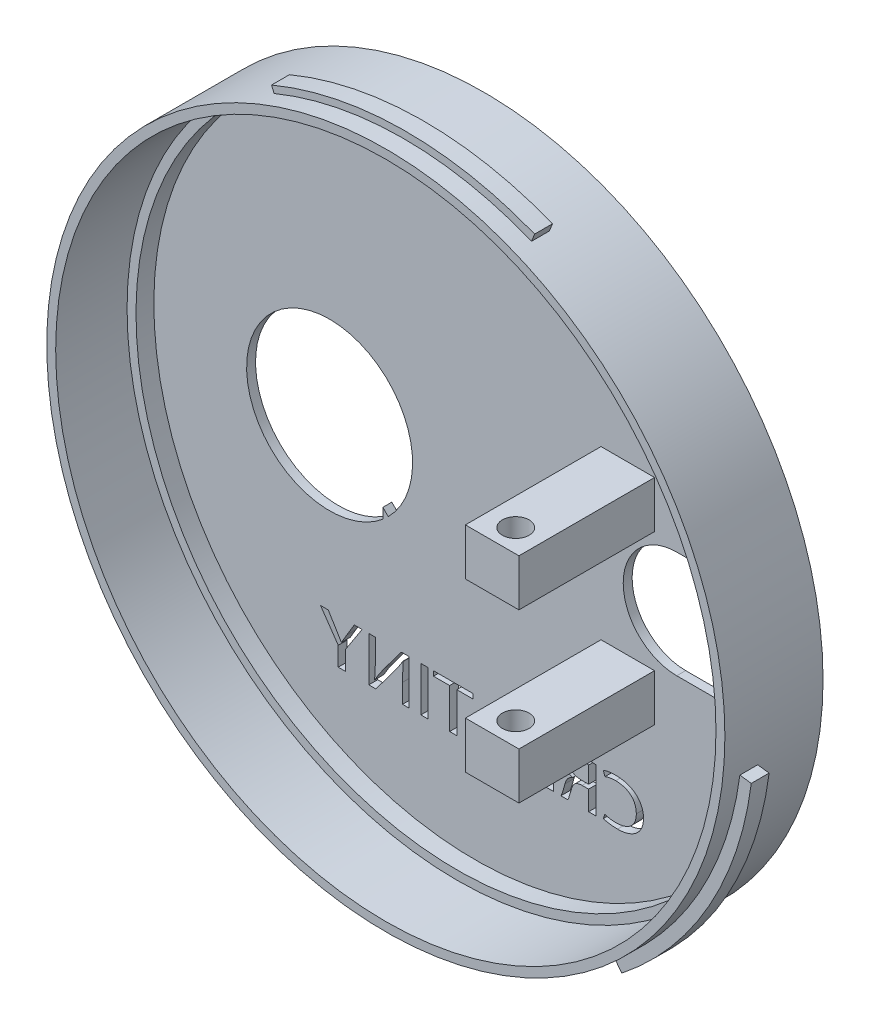
from build123d import *

# Parameters (mm, degrees)
SKETCH2_R           = 38
BOSS_EXTRUDE1_DEPTH = 10
BOSS_EXTRUDE2_START = -1
SKETCH3_R           = 38
BOSS_EXTRUDE2_DEPTH = 1
CUT_EXTRUDE3_DEPTH  = 11
SKETCH9_W           = 6
SKETCH9_H           = 5.25
BOSS_EXTRUDE3_DEPTH = 15.2
SKETCH10_R          = 1.5
CUT_EXTRUDE5_DEPTH  = 30.2
SKETCH13_W          = 0.801888887
SKETCH13_H          = 5
CUT_EXTRUDE6_DEPTH  = 1
BOSS_EXTRUDE5_START = 6
BOSS_EXTRUDE5_DEPTH = 2
SKETCH17_R          = 37
SKETCH17_R_2        = 34.556106302
CUT_EXTRUDE7_DEPTH  = 8


with BuildPart() as part:
    # Sketch2 → Boss-Extrude1 (new body)
    with BuildSketch(Plane.XY):
        with Locations((25.546999888, -56.770486832)):
            Circle(SKETCH2_R)
        with BuildLine():
            ThreePointArc((60.246626043, -47.182163482), (61.278669634, -52.383257966), (61.535520776, -57.679532627))
            ThreePointArc((61.535520776, -57.679532627), (61.396058346, -60.063662755), (61.098828905, -62.433300048))
            ThreePointArc((61.098828905, -62.433300048), (61.050025307, -62.731626496), (60.998718404, -63.029532627))
            ThreePointArc((60.998718404, -63.029532627), (25.546999888, -92.770486832), (-9.904718628, -63.029532627))
            ThreePointArc((-9.904718628, -63.029532627), (-10.273142163, -60.364568558), (-10.441521001, -57.679532627))
            ThreePointArc((-10.441521001, -57.679532627), (19.044551487, -21.362604026), (59.510267865, -44.833300048))
            Line((59.510267865, -44.833300048), (60.246626043, -44.833300048))
            Line((60.246626043, -44.833300048), (60.246626043, -47.182163482))
        make_face(mode=Mode.SUBTRACT)
    extrude(amount=BOSS_EXTRUDE1_DEPTH)

    # Sketch3 → Boss-Extrude2 (add)
    with BuildSketch(Plane.XY.offset(BOSS_EXTRUDE2_START)):
        with Locations((25.546999888, -56.770486832)):
            Circle(SKETCH3_R)
    extrude(amount=BOSS_EXTRUDE2_DEPTH)

    # Sketch8 → Cut-Extrude3 (cut)
    with BuildSketch(Plane.XY):
        with BuildLine():
            Line((15.21607418, -64.879468912), (15.21607418, -63.720910481))
            Line((15.21607418, -63.720910481), (15.820917047, -64.325753348))
            ThreePointArc((15.820917047, -64.325753348), (2.965046441, -50.890039737), (15.21607418, -64.879468912))
        make_face()
        with BuildLine():
            ThreePointArc((48.150499089, -51.605773888), (42.150499089, -57.605773888), (48.150499089, -63.605773888))
            Line((48.150499089, -63.605773888), (54.980546295, -63.605773888))
            ThreePointArc((54.980546295, -63.605773888), (56.712597103, -63.350336535), (58.297171086, -62.605773888))
            ThreePointArc((58.297171086, -62.605773888), (60.725108942, -55.873723081), (54.980546295, -51.605773888))
            Line((54.980546295, -51.605773888), (48.150499089, -51.605773888))
        make_face()
    extrude(amount=-CUT_EXTRUDE3_DEPTH, mode=Mode.SUBTRACT)

    # Sketch9 → Boss-Extrude3 (add)
    with BuildSketch(Plane.XY):
        with Locations((42.663966204, -48.230773888)):
            Rectangle(SKETCH9_W, SKETCH9_H)
        Polygon((45.663966204, -64.355773888), (39.663966204, -64.355773888), (39.663966204, -69.605773888), (45.663966204, -69.605773888), (45.663966204, -68.202006467), align=None)
    extrude(amount=BOSS_EXTRUDE3_DEPTH)

    # Sketch10 → Cut-Extrude5 (cut)
    with BuildSketch(Plane(origin=(0, -45.605773888, 0), x_dir=(1, 0, 0), z_dir=(0, 1, 0))):
        with Locations(Location((42.746446905, -12.639663568, 0), (0, 0, 270))):
            Circle(SKETCH10_R)
    extrude(amount=-CUT_EXTRUDE5_DEPTH, mode=Mode.SUBTRACT)

    # Sketch13 → Cut-Extrude6 (cut)
    # profile 1 of 8: a face of its own
    with BuildSketch(Plane(origin=(0, 0, -1), x_dir=(-1, 0, 0), z_dir=(0, 0, -1))):
        with BuildLine():
            Line((-40.104244244, -77.420287824), (-39.919238625, -76.89350522))
            add(Edge.make_bspline(
                [(-39.919238625, -76.89350522), (-39.985054462, -76.864755772), (-40.099036406, -76.827670091), (-40.269326593, -76.784978266), (-40.433726419, -76.750793916), (-40.622659337, -76.719221552), (-40.923593217, -76.68878046), (-41.161873876, -76.681558637), (-41.328515256, -76.679507378)],
                knots=[0, 0, 0, 0, 0.150125799, 0.250435981, 0.367340124, 0.501482822, 0.651140633, 1, 1, 1, 1], degree=3))
            add(Edge.make_bspline(
                [(-41.328515256, -76.679507378), (-41.551118359, -76.682349051), (-41.878080869, -76.705107722), (-42.297375573, -76.784199814), (-42.588134212, -76.861666839), (-42.860217223, -76.96378297), (-43.115298375, -77.086364928), (-43.352377266, -77.230635878), (-43.570737258, -77.395446782), (-43.768586362, -77.578162482), (-43.940626331, -77.77856157), (-44.088243958, -77.993415447), (-44.208456776, -78.224037529), (-44.303291152, -78.469702927), (-44.398543708, -78.823687705), (-44.424363123, -79.10307879), (-44.42885831, -79.2920717)],
                knots=[0, 0, 0, 0, 0.14690636, 0.215514431, 0.281217447, 0.345141972, 0.406923098, 0.467644647, 0.527895849, 0.58710749, 0.644941933, 0.701759103, 0.758694972, 0.816084307, 0.875151254, 1, 1, 1, 1], degree=3))
            add(Edge.make_bspline(
                [(-44.42885831, -79.2920717), (-44.426031396, -79.486385517), (-44.396500906, -79.770583678), (-44.304866617, -80.130869848), (-44.212364843, -80.375892275), (-44.095365607, -80.602699721), (-43.952072876, -80.810270398), (-43.785409494, -81.00030132), (-43.593503229, -81.169054285), (-43.383016352, -81.318726034), (-43.15737618, -81.449925507), (-42.917197587, -81.560675047), (-42.662616673, -81.650671869), (-42.393773518, -81.721686307), (-42.007784356, -81.789137586), (-41.708668421, -81.809337581), (-41.505402049, -81.809224359)],
                knots=[0, 0, 0, 0, 0.134054828, 0.196187605, 0.256037942, 0.314374007, 0.371821189, 0.429644386, 0.488326952, 0.547713857, 0.60759415, 0.668157831, 0.729921145, 0.793672145, 0.859786589, 1, 1, 1, 1], degree=3))
            add(Edge.make_bspline(
                [(-41.505402049, -81.809224359), (-41.333410545, -81.807122474), (-41.084443573, -81.799517854), (-40.765397705, -81.768840057), (-40.554487288, -81.737795521), (-40.364707434, -81.701640626), (-40.156901483, -81.653296502), (-40.013719027, -81.612905596), (-39.928429493, -81.578735508)],
                knots=[0, 0, 0, 0, 0.322335604, 0.466303064, 0.600284204, 0.721615014, 0.82815434, 1, 1, 1, 1], degree=3))
            Line((-39.928429493, -81.578735508), (-40.086584879, -81.068276407))
            add(Edge.make_bspline(
                [(-40.086584879, -81.068276407), (-40.171611189, -81.101493752), (-40.30657226, -81.146483426), (-40.497283578, -81.191391532), (-40.825450429, -81.25314188), (-41.108885014, -81.275623379), (-41.338163627, -81.276419899)],
                knots=[0, 0, 0, 0, 0.214735163, 0.334000252, 0.4606071, 1, 1, 1, 1], degree=3))
            add(Edge.make_bspline(
                [(-41.338163627, -81.276419899), (-41.510005248, -81.275914135), (-41.760830088, -81.256612925), (-42.082580191, -81.199084831), (-42.302064223, -81.139444563), (-42.505273326, -81.061809025), (-42.69374664, -80.969672613), (-42.865939974, -80.85993191), (-43.021825866, -80.734239277), (-43.160660588, -80.594136459), (-43.28258322, -80.441837951), (-43.384959772, -80.275869028), (-43.469946918, -80.098892901), (-43.535875196, -79.908969976), (-43.598992895, -79.633520332), (-43.619598338, -79.417687433), (-43.619467229, -79.270630877)],
                knots=[0, 0, 0, 0, 0.15004045, 0.219227057, 0.285263153, 0.348397162, 0.408984868, 0.468216069, 0.526376485, 0.583545824, 0.640194637, 0.696412641, 0.753518027, 0.811369344, 0.871641, 1, 1, 1, 1], degree=3))
            add(Edge.make_bspline(
                [(-43.619467229, -79.270630877), (-43.617636925, -79.114705853), (-43.597149875, -78.88577308), (-43.527547461, -78.594835206), (-43.456604372, -78.396437312), (-43.367004699, -78.212773824), (-43.259438979, -78.042522237), (-43.130649567, -77.887881571), (-42.984789233, -77.747148198), (-42.822094854, -77.62282396), (-42.645363068, -77.514036366), (-42.454553552, -77.421708998), (-42.250361244, -77.345601387), (-42.032533856, -77.286473016), (-41.716414469, -77.230720949), (-41.470669745, -77.212216707), (-41.302786268, -77.212311838)],
                knots=[0, 0, 0, 0, 0.133608295, 0.195976265, 0.255816817, 0.313729074, 0.370711517, 0.427897521, 0.485702881, 0.543992557, 0.602953592, 0.663194488, 0.725286128, 0.789374094, 0.856264557, 1, 1, 1, 1], degree=3))
            add(Edge.make_bspline(
                [(-41.302786268, -77.212311838), (-41.183720381, -77.215324772), (-41.00941851, -77.221832998), (-40.784688007, -77.247779023), (-40.629894893, -77.269217953), (-40.484815105, -77.29878616), (-40.308200377, -77.341965395), (-40.183523487, -77.387908531), (-40.104244244, -77.420287824)],
                knots=[0, 0, 0, 0, 0.292162388, 0.427031541, 0.554525321, 0.675141959, 0.789885124, 1, 1, 1, 1], degree=3))
        make_face()
    # profile 2 of 8: a face of its own
    with BuildSketch(Plane(origin=(0, 0, -1), x_dir=(-1, 0, 0), z_dir=(0, 0, -1))):
        with BuildLine():
            Line((-39.072940642, -81.743830895), (-38.271051756, -81.743830895))
            Line((-38.271051756, -81.743830895), (-38.271051756, -79.548290586))
            Line((-38.271051756, -79.548290586), (-37.542296178, -79.548290586))
            add(Edge.make_bspline(
                [(-37.542296178, -79.548290586), (-37.460927165, -79.551848822), (-37.342079172, -79.559952537), (-37.189553329, -79.586263277), (-37.085678143, -79.612444724), (-36.990001831, -79.647418472), (-36.900961532, -79.686919632), (-36.819233771, -79.733670014), (-36.745528549, -79.789643167), (-36.677318565, -79.852126403), (-36.614814129, -79.923337557), (-36.558347658, -80.003827619), (-36.503704784, -80.091289976), (-36.457798153, -80.19003106), (-36.396535297, -80.335349471), (-36.362866615, -80.452606341), (-36.343523833, -80.533495371)],
                knots=[0, 0, 0, 0, 0.14326879, 0.208951182, 0.271875185, 0.33128654, 0.387797679, 0.442962574, 0.496357282, 0.550149584, 0.605343085, 0.662520635, 0.722851415, 0.786346628, 0.853657941, 1, 1, 1, 1], degree=3))
            add(Edge.make_bspline(
                [(-36.343523833, -80.533495371), (-36.307360806, -80.679658413), (-36.245887827, -80.886249944), (-36.172934839, -81.149914949), (-36.1206278, -81.315249423), (-36.075512627, -81.458876407), (-36.020017914, -81.600383484), (-35.981797232, -81.69478214), (-35.949012684, -81.744901889)],
                knots=[0, 0, 0, 0, 0.35368249, 0.506518283, 0.642777006, 0.761213721, 0.860089839, 1, 1, 1, 1], degree=3))
            Line((-35.949012684, -81.744901889), (-35.171586018, -81.743830895))
            add(Edge.make_bspline(
                [(-35.171586018, -81.743830895), (-35.209472299, -81.680101131), (-35.258101821, -81.566643814), (-35.322309856, -81.398263236), (-35.376265226, -81.235919501), (-35.434204564, -81.050085609), (-35.520316261, -80.754216174), (-35.579949217, -80.518228992), (-35.623112169, -80.353392455)],
                knots=[0, 0, 0, 0, 0.151417113, 0.252398818, 0.369031531, 0.501655205, 0.651028209, 1, 1, 1, 1], degree=3))
            add(Edge.make_bspline(
                [(-35.623112169, -80.353392455), (-35.656152173, -80.230713566), (-35.71549081, -80.052987181), (-35.832976746, -79.84008722), (-35.929859539, -79.699301887), (-36.043451095, -79.576235639), (-36.220401237, -79.437426771), (-36.376241992, -79.367035461), (-36.485033267, -79.333881306)],
                knots=[0, 0, 0, 0, 0.272813509, 0.398602998, 0.520133142, 0.638268868, 0.75608641, 1, 1, 1, 1], degree=3))
            Line((-36.485033267, -79.333881306), (-36.484711864, -79.319577304))
            add(Edge.make_bspline(
                [(-36.484711864, -79.319577304), (-36.407353816, -79.299411684), (-36.294650268, -79.260954484), (-36.151871786, -79.195875809), (-36.050541352, -79.142407445), (-35.954904925, -79.08215084), (-35.86450475, -79.015609808), (-35.780058376, -78.942376622), (-35.70014409, -78.864586639), (-35.628498686, -78.779797319), (-35.56476175, -78.689724613), (-35.510855848, -78.593293474), (-35.465998133, -78.491724112), (-35.429959837, -78.384166205), (-35.395713816, -78.230346337), (-35.38510803, -78.11035658), (-35.382974948, -78.029207206)],
                knots=[0, 0, 0, 0, 0.130854223, 0.194484618, 0.256782832, 0.318309634, 0.379398059, 0.440388328, 0.50120996, 0.561820135, 0.621882741, 0.681613823, 0.742390406, 0.803450803, 0.867043523, 1, 1, 1, 1], degree=3))
            add(Edge.make_bspline(
                [(-35.382974948, -78.029207206), (-35.384249581, -77.932834562), (-35.397978423, -77.789701197), (-35.44881354, -77.607346027), (-35.50161366, -77.479942386), (-35.566863384, -77.36017042), (-35.672135848, -77.214383628), (-35.766622372, -77.118029195), (-35.837520402, -77.063298116)],
                knots=[0, 0, 0, 0, 0.261905724, 0.387865696, 0.512744574, 0.635647397, 0.757360791, 1, 1, 1, 1], degree=3))
            add(Edge.make_bspline(
                [(-35.837520402, -77.063298116), (-35.932188383, -76.993127175), (-36.092508039, -76.904454824), (-36.329059622, -76.818921809), (-36.531024548, -76.76528192), (-36.754885418, -76.72558002), (-37.099388934, -76.683513133), (-37.371538963, -76.676690563), (-37.560290557, -76.676291254)],
                knots=[0, 0, 0, 0, 0.196743967, 0.304307766, 0.419971224, 0.545726921, 0.684173603, 1, 1, 1, 1], degree=3))
            add(Edge.make_bspline(
                [(-37.560290557, -76.676291254), (-37.828080772, -76.677014392), (-38.160452629, -76.6860576), (-38.552822667, -76.713813501), (-38.789625073, -76.736531069), (-38.961899628, -76.756404887), (-39.072940642, -76.773847001)],
                knots=[0, 0, 0, 0, 0.529594647, 0.657124324, 0.777787018, 1, 1, 1, 1], degree=3))
            Line((-39.072940642, -76.773847001), (-39.072940642, -81.743830895))
        make_face()
        with BuildLine():
            Line((-37.48095951, -79.076591426), (-38.271051756, -79.076591426))
            Line((-38.271051756, -79.076591426), (-38.271051756, -77.207615376))
            add(Edge.make_bspline(
                [(-38.271051756, -77.207615376), (-38.232016991, -77.196840319), (-38.166505407, -77.185745807), (-38.071066266, -77.174032113), (-37.981734626, -77.165235529), (-37.880153312, -77.159395029), (-37.720818645, -77.151849712), (-37.59534546, -77.148355564), (-37.50776054, -77.147989368)],
                knots=[0, 0, 0, 0, 0.158137914, 0.259552694, 0.376096226, 0.509138643, 0.65745551, 1, 1, 1, 1], degree=3))
            add(Edge.make_bspline(
                [(-37.50776054, -77.147989368), (-37.409052415, -77.149132246), (-37.264268059, -77.15443253), (-37.07765645, -77.179802597), (-36.948897609, -77.203773336), (-36.828151362, -77.236110092), (-36.715103922, -77.275586781), (-36.609933711, -77.32308064), (-36.512075746, -77.376100421), (-36.423431894, -77.436862466), (-36.346465308, -77.507116762), (-36.28141853, -77.586385613), (-36.227914685, -77.673878523), (-36.183724767, -77.769136693), (-36.144159719, -77.912746557), (-36.13073988, -78.026344914), (-36.1291156, -78.104250088)],
                knots=[0, 0, 0, 0, 0.156480209, 0.229013275, 0.298179052, 0.363814758, 0.42683523, 0.487645763, 0.546422494, 0.602953773, 0.657444431, 0.710935013, 0.764819527, 0.819539052, 0.876690458, 1, 1, 1, 1], degree=3))
            add(Edge.make_bspline(
                [(-36.1291156, -78.104250088), (-36.130441378, -78.175264932), (-36.142429077, -78.27981526), (-36.181459091, -78.412483911), (-36.223077101, -78.50366597), (-36.273119977, -78.590535061), (-36.336392569, -78.670532036), (-36.410922068, -78.744017293), (-36.494438391, -78.813458598), (-36.589069779, -78.873565388), (-36.691253666, -78.927836711), (-36.802303488, -78.972872571), (-36.922106565, -79.00861089), (-37.04970672, -79.039162196), (-37.236537898, -79.067994828), (-37.381798689, -79.075231546), (-37.48095951, -79.076591426)],
                knots=[0, 0, 0, 0, 0.114278379, 0.168309448, 0.221848701, 0.275202354, 0.329267071, 0.385378573, 0.443396432, 0.50368652, 0.565418225, 0.629380707, 0.696135802, 0.766432636, 0.840361, 1, 1, 1, 1], degree=3))
        make_face(mode=Mode.SUBTRACT)
    # profile 3 of 8: a face of its own
    with BuildSketch(Plane(origin=(0, 0, -1), x_dir=(-1, 0, 0), z_dir=(0, 0, -1))):
        Polygon((-31.238108894, -78.874152574), (-33.536917965, -78.874152574), (-33.536917965, -77.280748684), (-31.097185733, -77.280748684), (-31.097185733, -76.747223947), (-34.338806852, -76.747223947), (-34.338806852, -81.740437843), (-30.965070269, -81.740437843), (-30.965070269, -81.206913105), (-33.536917965, -81.206913105), (-33.536917965, -79.407677312), (-31.238108894, -79.407677312), align=None)
    # profile 4 of 8: a face of its own
    with BuildSketch(Plane(origin=(0, 0, -1), x_dir=(-1, 0, 0), z_dir=(0, 0, -1))):
        Polygon((-26.945642454, -80.165786298), (-26.316086279, -81.743830895), (-25.503038324, -81.743830895), (-27.513991779, -76.747223947), (-28.423350698, -76.747223947), (-30.434432924, -81.743830895), (-29.638743869, -81.743830895), (-29.035419202, -80.165786298), align=None)
        with BuildLine():
            Line((-28.878030158, -79.694087138), (-28.300936997, -78.209519505))
            add(Edge.make_bspline(
                [(-28.300936997, -78.209519505), (-28.133758621, -77.752369865), (-28.012691929, -77.280922472)],
                knots=[0, 0, 0, 1, 1, 1], degree=2))
            Line((-28.012691929, -77.280922472), (-27.98615891, -77.280747637))
            add(Edge.make_bspline(
                [(-27.98615891, -77.280747637), (-27.945733289, -77.433455556), (-27.848294072, -77.747461477), (-27.740616119, -78.058069123), (-27.680359167, -78.217886452)],
                knots=[0, 0, 0, 0, 0.480444352, 1, 1, 1, 1], degree=3))
            Line((-27.680359167, -78.217886452), (-27.103031498, -79.694087138))
            Line((-27.103031498, -79.694087138), (-28.878030158, -79.694087138))
        make_face(mode=Mode.SUBTRACT)
    # profile 5 of 8: a face of its own
    with BuildSketch(Plane(origin=(0, 0, -1), x_dir=(-1, 0, 0), z_dir=(0, 0, -1))):
        Polygon((-23.49832553, -81.743830895), (-22.696436644, -81.743830895), (-22.696436644, -77.280747637), (-20.88205094, -77.280747637), (-20.88205094, -76.747223947), (-25.303903536, -76.747223947), (-25.303903536, -77.280747637), (-23.49832553, -77.280747637), align=None)
    # profile 6 of 8: a face of its own
    with BuildSketch(Plane(origin=(0, 0, -1), x_dir=(-1, 0, 0), z_dir=(0, 0, -1))):
        with Locations((-19.872682305, -79.243830895)):
            Rectangle(SKETCH13_W, SKETCH13_H)
    # profile 7 of 8: a face of its own
    with BuildSketch(Plane(origin=(0, 0, -1), x_dir=(-1, 0, 0), z_dir=(0, 0, -1))):
        with BuildLine():
            Line((-17.413418823, -81.743830895), (-17.413418823, -79.607319853))
            add(Edge.make_bspline(
                [(-17.413418823, -79.607319853), (-17.414668072, -79.415055359), (-17.413538979, -79.133740714), (-17.421834508, -78.768545443), (-17.433499332, -78.278310661), (-17.454038012, -77.877352007), (-17.475599305, -77.560725217)],
                knots=[0, 0, 0, 0, 0.281664708, 0.412034862, 0.535090257, 1, 1, 1, 1], degree=3))
            Line((-17.475599305, -77.560725217), (-17.448738601, -77.552150981))
            add(Edge.make_bspline(
                [(-17.448738601, -77.552150981), (-17.290452417, -77.835938066), (-16.931257278, -78.400808494), (-16.536206449, -78.940877055), (-16.329587298, -79.215956778)],
                knots=[0, 0, 0, 0, 0.485600781, 1, 1, 1, 1], degree=3))
            Line((-16.329587298, -79.215956778), (-14.426594879, -81.743830895))
            Line((-14.426594879, -81.743830895), (-13.639830777, -81.743830895))
            Line((-13.639830777, -81.743830895), (-13.639830777, -76.750263142))
            Line((-13.639830777, -76.750263142), (-14.373109028, -76.750263142))
            Line((-14.373109028, -76.750263142), (-14.373109028, -78.853454014))
            add(Edge.make_bspline(
                [(-14.373109028, -78.853454014), (-14.37457794, -79.039694141), (-14.372000987, -79.313849858), (-14.36528407, -79.672337286), (-14.348166615, -80.176537866), (-14.319051947, -80.592286561), (-14.284132752, -80.922646315)],
                knots=[0, 0, 0, 0, 0.269628308, 0.396925557, 0.519093035, 1, 1, 1, 1], degree=3))
            Line((-14.284132752, -80.922646315), (-14.301567031, -80.929078562))
            add(Edge.make_bspline(
                [(-14.301567031, -80.929078562), (-14.375458458, -80.798709816), (-14.489687891, -80.601077668), (-14.653918018, -80.33944817), (-14.78413173, -80.135482074), (-14.923076098, -79.928854956), (-15.118584631, -79.642761586), (-15.272438913, -79.428720008), (-15.378686783, -79.285639453)],
                knots=[0, 0, 0, 0, 0.228665894, 0.348185411, 0.471297315, 0.597869182, 0.728080882, 1, 1, 1, 1], degree=3))
            Line((-15.378686783, -79.285639453), (-17.288967825, -76.743830895))
            Line((-17.288967825, -76.743830895), (-18.146697075, -76.743830895))
            Line((-18.146697075, -76.743830895), (-18.146697075, -81.743829848))
            Line((-18.146697075, -81.743829848), (-17.413418823, -81.743830895))
        make_face()
    # profile 8 of 8: a face of its own
    with BuildSketch(Plane(origin=(0, 0, -1), x_dir=(-1, 0, 0), z_dir=(0, 0, -1))):
        with BuildLine():
            Line((-10.209301138, -81.743830895), (-10.209301138, -79.614738294))
            Line((-10.209301138, -79.614738294), (-8.22756918, -76.743830895))
            Line((-8.22756918, -76.743830895), (-9.090723544, -76.743830895))
            Line((-9.090723544, -76.743830895), (-9.94507021, -78.123631629))
            add(Edge.make_bspline(
                [(-9.94507021, -78.123631629), (-10.057830815, -78.300491239), (-10.266790116, -78.641070162), (-10.466626513, -78.987127569), (-10.555573576, -79.154850431)],
                knots=[0, 0, 0, 0, 0.524939289, 1, 1, 1, 1], degree=3))
            Line((-10.555573576, -79.154850431), (-10.573797228, -79.154794945))
            add(Edge.make_bspline(
                [(-10.573797228, -79.154794945), (-10.66841177, -78.987777556), (-10.868167387, -78.643101676), (-11.073339551, -78.301629266), (-11.179501534, -78.12461887)],
                knots=[0, 0, 0, 0, 0.481858599, 1, 1, 1, 1], degree=3))
            Line((-11.179501534, -78.12461887), (-12.01526755, -76.743830895))
            Line((-12.01526755, -76.743830895), (-12.887229611, -76.743830895))
            Line((-12.887229611, -76.743830895), (-11.011190024, -79.629575176))
            Line((-11.011190024, -79.629575176), (-11.011190024, -81.743830895))
            Line((-11.011190024, -81.743830895), (-10.209301138, -81.743830895))
        make_face()
    extrude(amount=-CUT_EXTRUDE6_DEPTH, mode=Mode.SUBTRACT)


with BuildPart() as cut_extrude6_piece_1:
    # of the separate pieces the step leaves, piece 1, a body of its own (cut_extrude6_pieces)
    add(part.part.solids().sort_by_distance((63.546999888, -56.770486832, 10))[0])

    # Sketch14 → Boss-Extrude5 (add)
    with BuildSketch(Plane.XY.offset(BOSS_EXTRUDE5_START)):
        with BuildLine():
            Line((10.742171614, -20.973685841), (11.565126377, -22.937465297))
            ThreePointArc((11.565126377, -22.937465297), (25.475780705, -20.073772608), (39.436870173, -22.680498617))
            Line((39.436870173, -22.680498617), (40.22347755, -20.701879621))
            ThreePointArc((40.22347755, -20.701879621), (25.456150725, -17.944618091), (10.742171614, -20.973685841))
        make_face()
        with BuildLine():
            Line((64.502770456, -61.873539291), (62.390610178, -61.604349293))
            ThreePointArc((62.390610178, -61.604349293), (57.915313631, -75.083175669), (48.677277952, -85.870470809))
            Line((48.677277952, -85.870470809), (49.997508579, -87.541002277))
            ThreePointArc((49.997508579, -87.541002277), (59.769030521, -76.130752866), (64.502770456, -61.873539291))
        make_face()
        with BuildLine():
            Line((2.202158936, -87.981656885), (3.491364451, -86.287067426))
            ThreePointArc((3.491364451, -86.287067426), (-5.94399333, -75.671933739), (-10.66704712, -62.277912591))
            Line((-10.66704712, -62.277912591), (-12.773885123, -62.586000118))
            ThreePointArc((-12.773885123, -62.586000118), (-7.77808024, -76.753511059), (2.202158936, -87.981656885))
        make_face()
    extrude(amount=BOSS_EXTRUDE5_DEPTH)

    # Sketch17 → Cut-Extrude7 (cut)
    with BuildSketch(Plane.XY.offset(10)):
        with Locations((25.546999888, -56.770486832)):
            Circle(SKETCH17_R)
        with Locations((25.546999888, -56.770486832)):
            Circle(SKETCH17_R_2, mode=Mode.SUBTRACT)
    extrude(amount=-CUT_EXTRUDE7_DEPTH, mode=Mode.SUBTRACT)


with BuildPart() as cut_extrude6_piece_2:
    # of the separate pieces the step leaves, piece 2, a body of its own (cut_extrude6_pieces)
    add(part.part.solids().sort_by_distance((36.1291156, -78.104250088, -1))[0])


with BuildPart() as cut_extrude6_piece_3:
    # of the separate pieces the step leaves, piece 3, a body of its own (cut_extrude6_pieces)
    add(part.part.solids().sort_by_distance((27.103031498, -79.694087138, -1))[0])


solid = Compound([cut_extrude6_piece_1.part, cut_extrude6_piece_2.part, cut_extrude6_piece_3.part])
